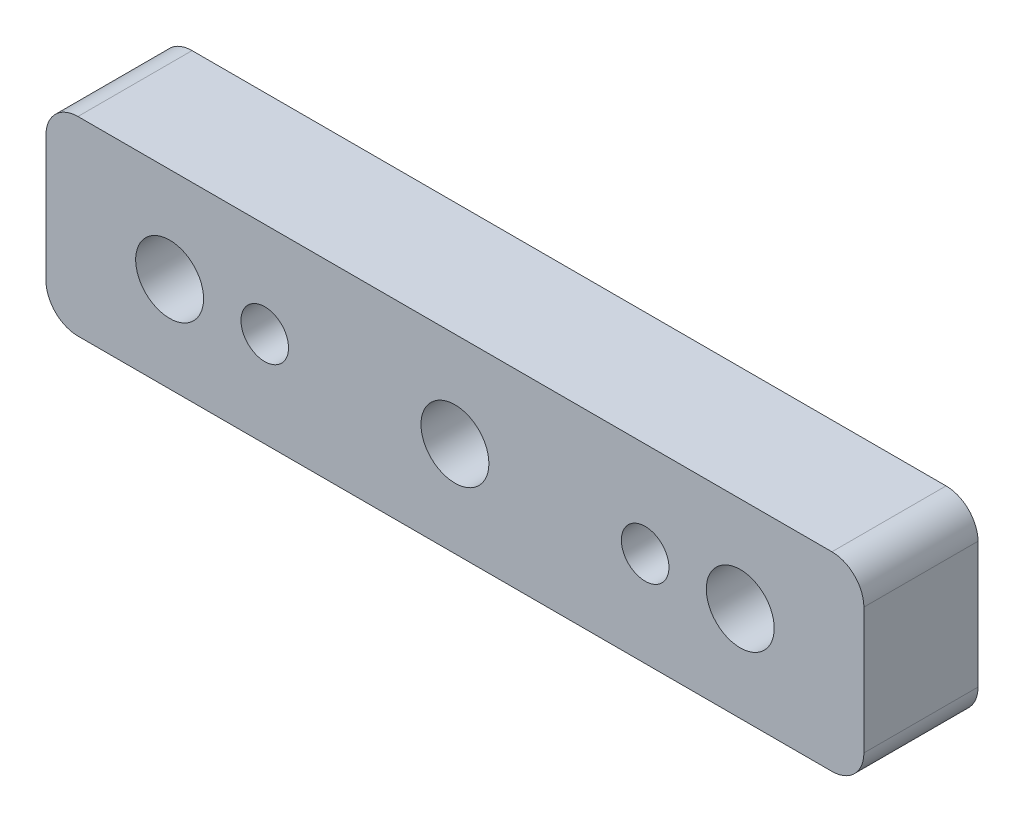
from build123d import *

# Parameters (mm, degrees)
SKETCH1_R           = 3.57
SKETCH1_R_2         = 2.5
BOSS_EXTRUDE1_DEPTH = 6


with BuildPart() as part:
    # Sketch1 → Boss-Extrude1 (new, symmetric)
    with BuildSketch(Plane.XY):
        with BuildLine():
            Line((-39.64, -10), (39.64, -10))
            ThreePointArc((39.64, -10), (42.015878785, -9.015878785), (43, -6.64))
            Line((43, -6.64), (43, 6.64))
            ThreePointArc((43, 6.64), (42.015878785, 9.015878785), (39.64, 10))
            Line((39.64, 10), (-39.64, 10))
            ThreePointArc((-39.64, 10), (-42.015878785, 9.015878785), (-43, 6.64))
            Line((-43, 6.64), (-43, -6.64))
            ThreePointArc((-43, -6.64), (-42.015878785, -9.015878785), (-39.64, -10))
        make_face()
        with Locations((-30, 0)):
            Circle(SKETCH1_R, mode=Mode.SUBTRACT)
        Circle(SKETCH1_R, mode=Mode.SUBTRACT)
        with Locations((30, 0)):
            Circle(SKETCH1_R, mode=Mode.SUBTRACT)
        with Locations((-20, 0)):
            Circle(SKETCH1_R_2, mode=Mode.SUBTRACT)
        with Locations((20, 0)):
            Circle(SKETCH1_R_2, mode=Mode.SUBTRACT)
    extrude(amount=BOSS_EXTRUDE1_DEPTH, both=True)


solid = part.part
